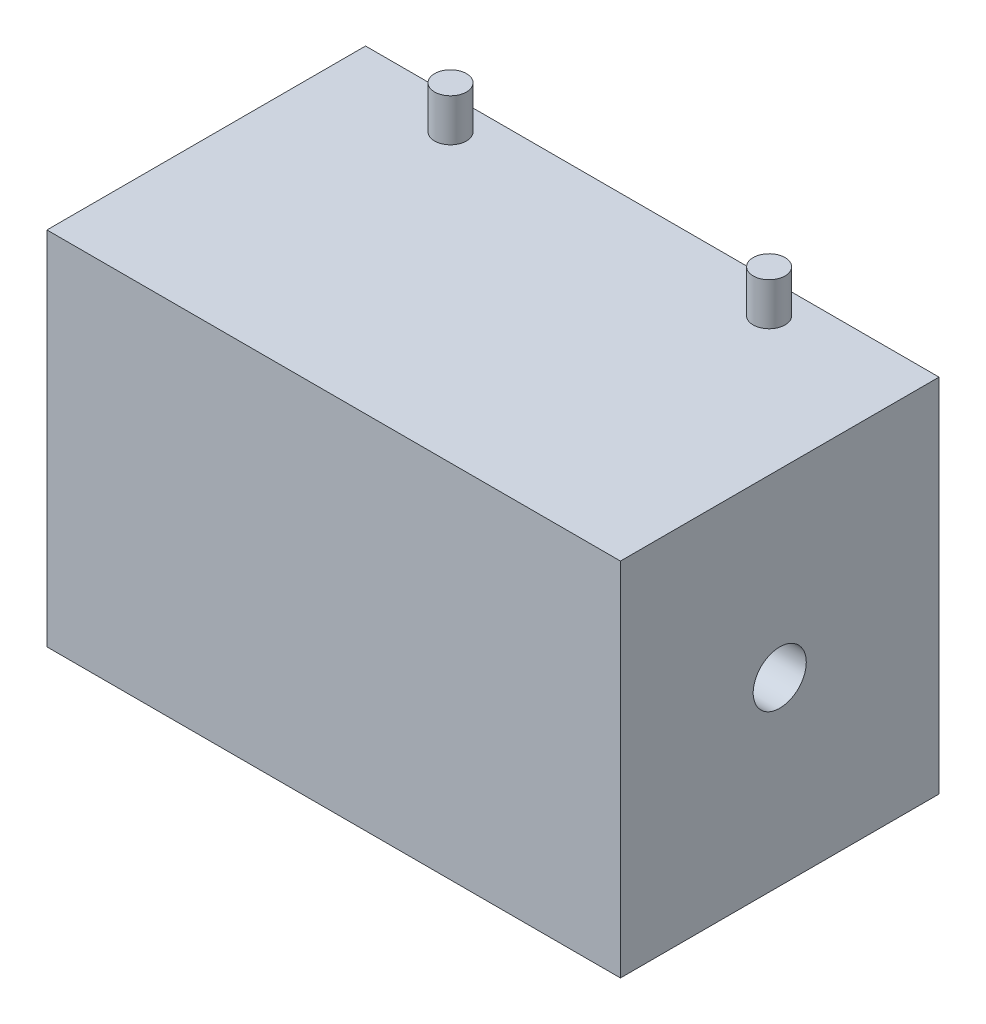
from build123d import *

# Parameters (mm, degrees)
SKETCH1_W                = 270
SKETCH1_H                = 170
BOSS_EXTRUDE1_DEPTH      = 150
SKETCH2_R                = 12.5
CUT_EXTRUDE1_DEPTH       = 200
BOSS_EXTRUDE2_DEPTH      = 20
BOSS_EXTRUDE2_DEPTH_BACK = 190
SKETCH3_R                = 7.5


with BuildPart() as part:
    # Sketch1 → Boss-Extrude1 (new body)
    with BuildSketch(Plane.XY):
        with Locations((135, 85)):
            Rectangle(SKETCH1_W, SKETCH1_H)
    extrude(amount=BOSS_EXTRUDE1_DEPTH)

    # Sketch2 → Cut-Extrude1 (cut)
    with BuildSketch(Plane(origin=(270, 0, 0), x_dir=(0, 0, -1), z_dir=(1, 0, 0))):
        with Locations((-75, 85)):
            Circle(SKETCH2_R)
    extrude(amount=-CUT_EXTRUDE1_DEPTH, mode=Mode.SUBTRACT)

    # Sketch3 → Boss-Extrude2 (add, two sides: drawn at the far end of the back side and taken through both)
    with BuildSketch(Plane.XZ.offset(-BOSS_EXTRUDE2_DEPTH_BACK)):
        with Locations(Location((55, 15, 0), (0, 0, 270))):
            Circle(SKETCH3_R)
        with Locations(Location((205, 15, 0), (0, 0, 270))):
            Circle(SKETCH3_R)
    extrude(amount=BOSS_EXTRUDE2_DEPTH + BOSS_EXTRUDE2_DEPTH_BACK)


solid = part.part
